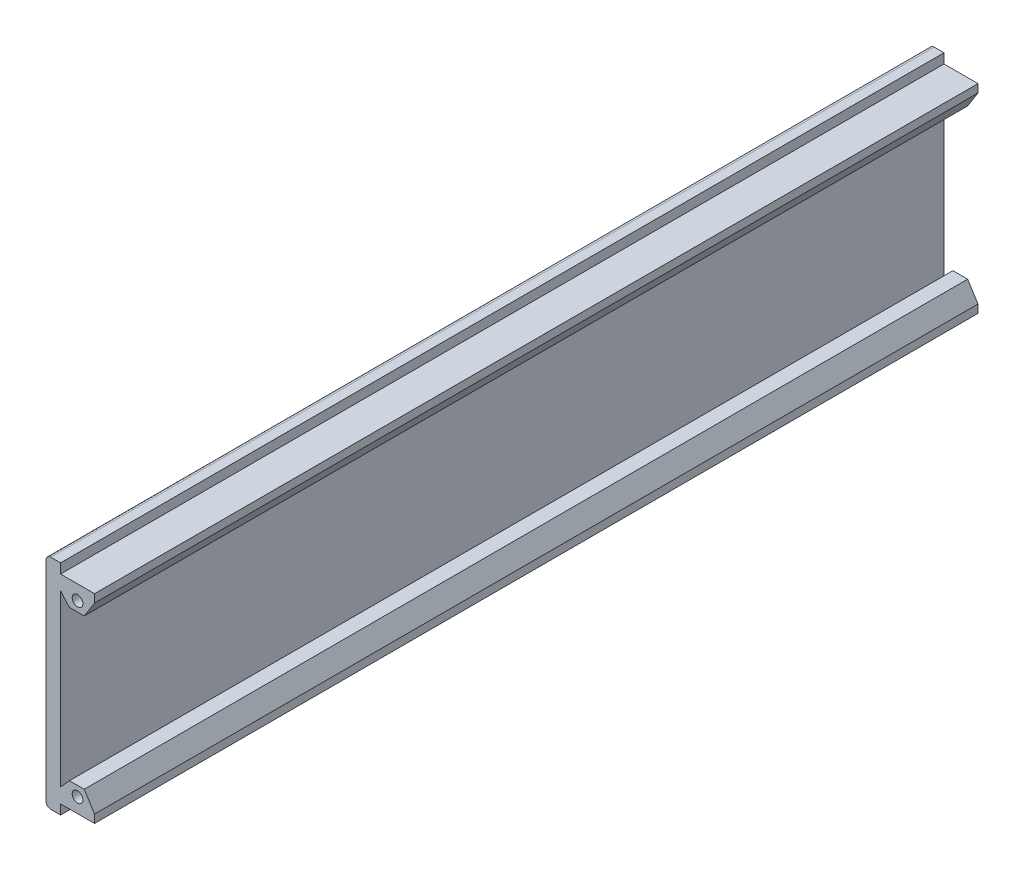
from build123d import *

# Parameters (mm, degrees)
SKETCH_1_R      = 1.102856911
EXTRUDE_1_DEPTH = 182


with BuildPart() as part:
    # 草图1 → 凸台-拉伸1 (new body)
    with BuildSketch(Plane.XY):
        with BuildLine():
            Line((1, 45), (3, 45))
            Line((3, 45), (3, 43))
            Line((3, 43), (10, 43))
            Line((10, 43), (10, 41.324203171))
            Line((10, 41.324203171), (7.873486532, 37.954843198))
            Line((7.873486532, 37.954843198), (4.832988285, 37.954843198))
            Line((4.832988285, 37.954843198), (3, 40))
            Line((3, 40), (3, 5))
            Line((3, 5), (4.832988285, 7.045156802))
            Line((4.832988285, 7.045156802), (7.873486532, 7.045156802))
            Line((7.873486532, 7.045156802), (10, 3.675796829))
            Line((10, 3.675796829), (10, 2))
            Line((10, 2), (3, 2))
            Line((3, 2), (3, 0))
            Line((3, 0), (1, 0))
            ThreePointArc((1, 0), (0.292893219, 0.292893219), (0, 1))
            Line((0, 1), (0, 44))
            ThreePointArc((0, 44), (0.292893219, 44.707106781), (1, 45))
        make_face()
        with Locations((6.5, 5)):
            Circle(SKETCH_1_R, mode=Mode.SUBTRACT)
        with Locations((6.5, 40)):
            Circle(SKETCH_1_R, mode=Mode.SUBTRACT)
    extrude(amount=EXTRUDE_1_DEPTH)


solid = part.part
